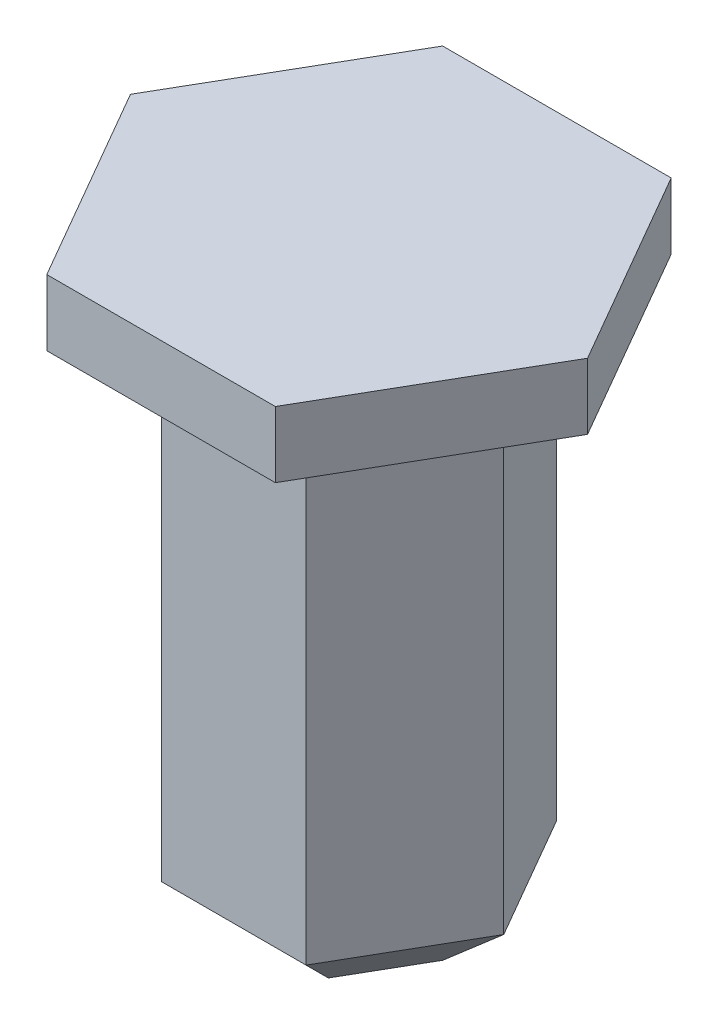
from build123d import *

# Parameters (mm, degrees)
BOSS_EXTRUDE1_DEPTH = 8
BOSS_EXTRUDE2_DEPTH = 1
CHAMFER1_SIZE       = 0.8


with BuildPart() as part:
    # Sketch1 → Boss-Extrude1 (new body)
    with BuildSketch(Plane(origin=(0, 0, 0), x_dir=(1, 0, 0), z_dir=(0, 1, 0))):
        Polygon((2.193931023, 0), (1.096965511, 1.9), (-1.096965511, 1.9), (-2.193931023, 0), (-1.096965511, -1.9), (1.096965511, -1.9), align=None)
    extrude(amount=BOSS_EXTRUDE1_DEPTH)

    # Sketch2 → Boss-Extrude2 (add)
    with BuildSketch(Plane(origin=(0, 8, 0), x_dir=(1, 0, 0), z_dir=(0, 1, 0))):
        Polygon((3.464101615, 0), (1.732050808, 3), (-1.732050808, 3), (-3.464101615, 0), (-1.732050808, -3), (1.732050808, -3), align=None)
    extrude(amount=BOSS_EXTRUDE2_DEPTH)

    # Chamfer1
    chamfer1_edges = [part.edges().sort_by_distance(p)[0] for p in [
        (1.645448267, 0, -0.95),
        (1.645448267, 0, 0.95),
        (0, 0, 1.9),
        (-1.645448267, 0, 0.95),
        (-1.645448267, 0, -0.95),
        (0, 0, -1.9),
    ]]
    chamfer(chamfer1_edges, length=CHAMFER1_SIZE)


solid = part.part
